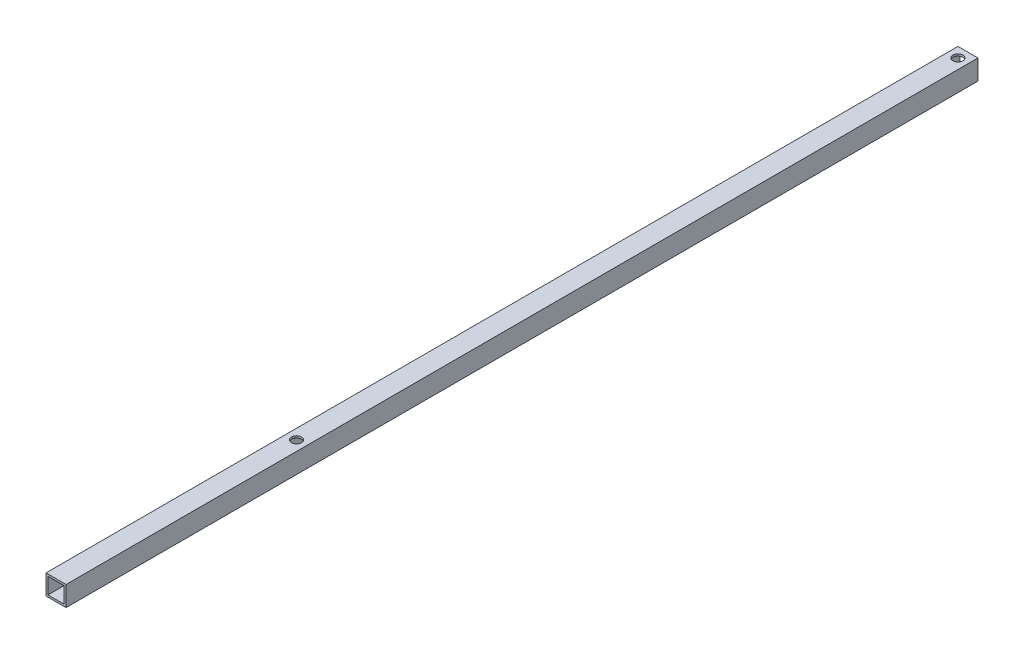
from build123d import *

# Parameters (mm, degrees)
SKETCH1_W               = 25.4
SKETCH1_H               = 25.4
SKETCH1_W_2             = 20.32
SKETCH1_H_2             = 20.32
BOSS_EXTRUDE1_DEPTH     = 1155.7
SKETCH2_R               = 6.35
CUT_EXTRUDE1_DEPTH      = 1157.258106999
CUT_EXTRUDE2_DEPTH      = 1157.258106999
CUT_EXTRUDE2_DEPTH_BACK = 1157.258106999
SKETCH3_R               = 6.35


with BuildPart() as part:
    # Sketch1 → Boss-Extrude1 (new body)
    with BuildSketch(Plane.XY):
        with Locations((12.7, 12.7)):
            Rectangle(SKETCH1_W, SKETCH1_H)
        with Locations((12.7, 12.7)):
            Rectangle(SKETCH1_W_2, SKETCH1_H_2, mode=Mode.SUBTRACT)
    extrude(amount=BOSS_EXTRUDE1_DEPTH)

    # Sketch2 → Cut-Extrude1 (cut, through all)
    with BuildSketch(Plane.XZ):
        with Locations(Location((12.7, 12.7, 0), (0, 0, 270))):
            Circle(SKETCH2_R)
    extrude(amount=-CUT_EXTRUDE1_DEPTH, mode=Mode.SUBTRACT)

    # Sketch3 → Cut-Extrude2 (cut, two sides: drawn at the far end of the back side and taken through both)
    with BuildSketch(Plane.XZ.offset(-CUT_EXTRUDE2_DEPTH_BACK)):
        with Locations(Location((12.7, 850.9, 0), (0, 0, 270))):
            Circle(SKETCH3_R)
    extrude(amount=CUT_EXTRUDE2_DEPTH + CUT_EXTRUDE2_DEPTH_BACK, mode=Mode.SUBTRACT)


solid = part.part
